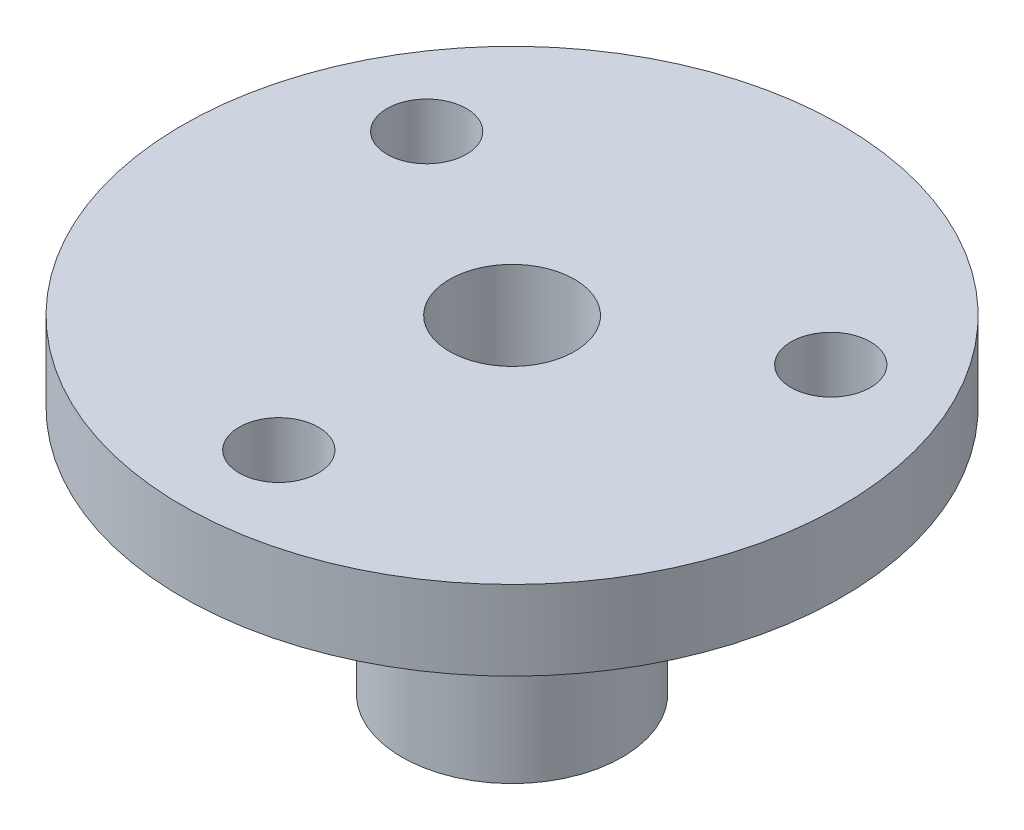
from build123d import *

# Parameters (mm, degrees)
ESQUISSE2_R             = 2
ENL_V_MAT_EXTRU_1_DEPTH = 27.596428332


with BuildPart() as part:
    # Esquisse1 → Révolution1 (revolve)
    with BuildSketch(Plane.XY, mode=Mode.PRIVATE) as r_volution1_sk:
        with BuildLine():
            Line((16.6, 16.5), (3.15, 16.5))
            Line((3.15, 16.5), (3.15, 0))
            Line((3.15, 0), (5.55, 0))
            Line((5.55, 0), (5.55, 10))
            ThreePointArc((5.55, 10), (6.282233047, 11.767766953), (8.05, 12.5))
            Line((8.05, 12.5), (16.6, 12.5))
            Line((16.6, 12.5), (16.6, 16.5))
        make_face()
    revolve(r_volution1_sk.sketch.rotate(Axis((0, 0, 0), (0, 1, 0)), 90), axis=Axis((0, 0, 0), (0, 1, 0)))

    # Esquisse2 → Enlèv. mat.-Extru.1 (cut, through all)
    with BuildSketch(Plane.XZ.offset(-12.5)):
        with Locations(Location((0, 11.75, 0), (0, 0, 270))):
            Circle(ESQUISSE2_R)
        with Locations(Location((10.175798494, -5.875, 0), (0, 0, 270))):
            Circle(ESQUISSE2_R)
        with Locations(Location((-10.175798494, -5.875, 0), (0, 0, 270))):
            Circle(ESQUISSE2_R)
    extrude(amount=-ENL_V_MAT_EXTRU_1_DEPTH, mode=Mode.SUBTRACT)


solid = part.part
